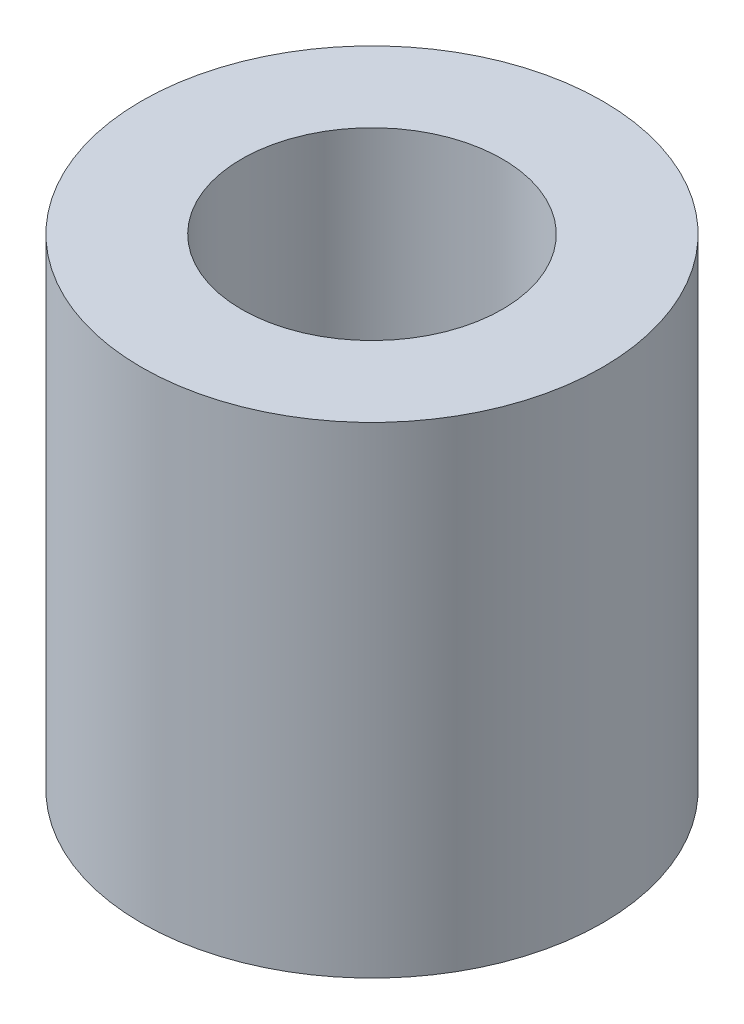
from build123d import *

# Parameters (mm, degrees)
SKETCH1_R   = 5.75
SKETCH1_R_2 = 3.25
BODY_DEPTH  = 12


with BuildPart() as part:
    # Sketch1 → Body (new body)
    with BuildSketch(Plane(origin=(0, 0, 0), x_dir=(1, 0, 0), z_dir=(0, 1, 0))):
        with Locations(Location((0, 0, 0), (0, 0, 270))):
            Circle(SKETCH1_R)
        with Locations(Location((0, 0, 0), (0, 0, 270))):
            Circle(SKETCH1_R_2, mode=Mode.SUBTRACT)
    extrude(amount=BODY_DEPTH)


solid = part.part
